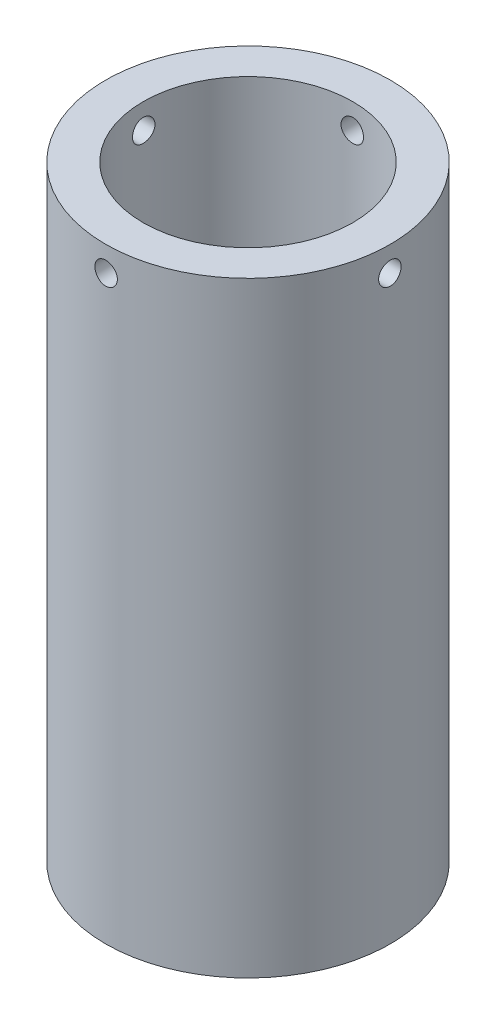
from build123d import *

# Parameters (mm, degrees)
SKETCH1_R           = 28.5
SKETCH1_R_2         = 21
BOSS_EXTRUDE1_DEPTH = 60.675
SKETCH2_R           = 2.25
CUT_EXTRUDE1_DEPTH  = 73.841990809
CIRPATTERN1_COUNT   = 4
SKETCH3_R           = 2.25
CUT_EXTRUDE2_DEPTH  = 6.5


with BuildPart() as part:
    # Sketch1 → Boss-Extrude1 (new, symmetric)
    with BuildSketch(Plane(origin=(0, 0, 0), x_dir=(1, 0, 0), z_dir=(0, 1, 0))):
        with Locations(Location((0, 0, 0), (0, 0, 270))):
            Circle(SKETCH1_R)
        with Locations(Location((0, 0, 0), (0, 0, 270))):
            Circle(SKETCH1_R_2, mode=Mode.SUBTRACT)
    extrude(amount=BOSS_EXTRUDE1_DEPTH, both=True)

    # Sketch2 → Cut-Extrude1 (cut, through all)
    with BuildSketch(Plane.XY):
        with Locations(Location((0, 55.675, 0), (0, 0, 90))):
            Circle(SKETCH2_R)
    cut_extrude1 = extrude(amount=-CUT_EXTRUDE1_DEPTH, mode=Mode.SUBTRACT)

    # CirPattern1: Cut-Extrude1 ×4 about axis
    cirpattern1_axis = Axis((0, 60.675, 0), (0, -1, 0))
    for i in range(1, CIRPATTERN1_COUNT):
        add(cut_extrude1.rotate(cirpattern1_axis, i * 360 / CIRPATTERN1_COUNT), mode=Mode.SUBTRACT)

    # Sketch3 → Cut-Extrude2 (cut)
    with BuildSketch(Plane.XZ.offset(60.675)):
        with Locations(Location((0, 24.75, 0), (0, 0, 270))):
            Circle(SKETCH3_R)
        with Locations(Location((24.75, 0, 0), (0, 0, 270))):
            Circle(SKETCH3_R)
        with Locations(Location((0, -24.75, 0), (0, 0, 270))):
            Circle(SKETCH3_R)
        with Locations(Location((-24.75, 0, 0), (0, 0, 270))):
            Circle(SKETCH3_R)
    extrude(amount=-CUT_EXTRUDE2_DEPTH, mode=Mode.SUBTRACT)


solid = part.part
